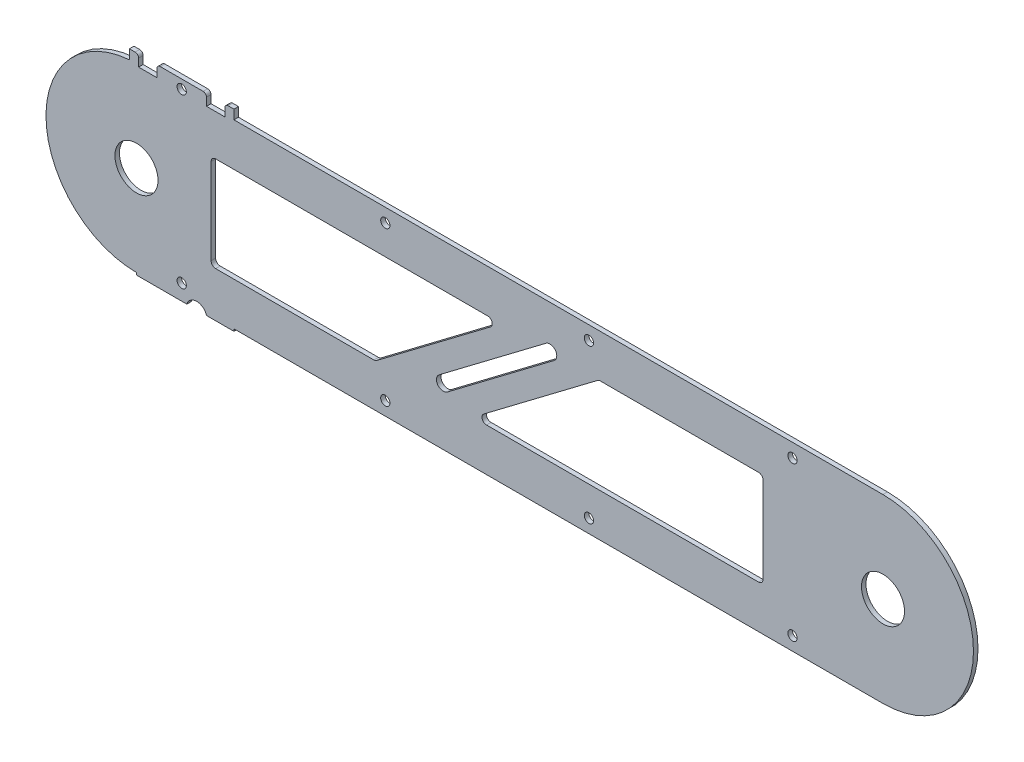
from build123d import *

# Parameters (mm, degrees)
SKETCH_1_R          = 9.52
EXTRUDE_1_DEPTH     = 2
SKETCH_4_W          = 43.1
SKETCH_4_H          = 0.98
SKETCH_4_W_2        = 46.2
SKETCH_4_H_2        = 8.602857229
EXTRUDE_2_DEPTH     = 2
SKETCH_2_R          = 2.05
CUT_EXTRUDE_1_DEPTH = 4
CUT_EXTRUDE_2_DEPTH = 10
FILLET_1_R          = 2
CUT_EXTRUDE_3_DEPTH = 2
FILLET_2_R          = 1.5


with BuildPart() as part:
    # 草图1 → 凸台-拉伸1 (new body)
    with BuildSketch(Plane.XY):
        with BuildLine():
            Line((328.542857143, -40.145714286), (-1.457142857, -40.145714286))
            ThreePointArc((-1.457142857, -40.145714286), (-41.457142857, -0.145714286), (-1.457142857, 39.854285714))
            Line((-1.457142857, 39.854285714), (328.542857143, 39.854285714))
            ThreePointArc((328.542857143, 39.854285714), (368.542857143, -0.145714286), (328.542857143, -40.145714286))
        make_face()
        with Locations((-1.457142857, -0.145714286)):
            Circle(SKETCH_1_R, mode=Mode.SUBTRACT)
        with Locations((328.542857143, -0.145714286)):
            Circle(SKETCH_1_R, mode=Mode.SUBTRACT)
    extrude(amount=EXTRUDE_1_DEPTH)

    # 草图4 → 凸台-拉伸2 (add)
    with BuildSketch(Plane.XY.offset(2)):
        with Locations((20.092857143, -40.635714286)):
            Rectangle(SKETCH_4_W, SKETCH_4_H)
        with Locations((18.542857143, 39.652857099)):
            Rectangle(SKETCH_4_W_2, SKETCH_4_H_2)
    extrude(amount=-EXTRUDE_2_DEPTH)

    # 草图2 → 切除-拉伸1 (cut)
    with BuildSketch(Plane.XY.offset(2)):
        with Locations((108.542857143, 33.854285714)):
            Circle(SKETCH_2_R)
        with Locations((198.542857143, 33.854285714)):
            Circle(SKETCH_2_R)
        with Locations((288.542857143, 33.854285714)):
            Circle(SKETCH_2_R)
        with Locations((108.542857143, -34.145714286)):
            Circle(SKETCH_2_R)
        with Locations((198.542857143, -34.145714286)):
            Circle(SKETCH_2_R)
        with Locations((288.542857143, -34.145714286)):
            Circle(SKETCH_2_R)
        with Locations((18.542857143, -34.145714286)):
            Circle(SKETCH_2_R)
        with Locations((18.542857143, 40.014285714)):
            Circle(SKETCH_2_R)
        Polygon((31.542857143, -21.145714286), (104.183898028, -21.145714286), (159.772133322, 20.854285714), (31.542857143, 20.854285714), align=None)
        Polygon((275.542857143, 20.854285714), (202.901816258, 20.854285714), (147.313580964, -21.145714286), (275.542857143, -21.145714286), align=None)
        Polygon((29.492857143, 41.064285714), (29.492857143, 38.964285714), (37.592857143, 38.964285714), (37.592857143, 41.064285714), (37.592857143, 53.579710622), (29.492857143, 53.579710622), align=None)
        Polygon((-0.507142857, 41.064285714), (-0.507142857, 38.964285714), (7.592857143, 38.964285714), (7.592857143, 41.064285714), (7.592857143, 53.579710622), (-0.507142857, 53.579710622), align=None)
    extrude(amount=-CUT_EXTRUDE_1_DEPTH, mode=Mode.SUBTRACT)

    # 草图3 → 切除-拉伸2 (cut)
    with BuildSketch(Plane.XY.offset(2)):
        with BuildLine():
            Line((183.145474057, 18.460683743), (135.97586329, -17.178577727))
            ThreePointArc((135.97586329, -17.178577727), (131.77376205, -16.593475022), (132.358864754, -12.391373783))
            Line((132.358864754, -12.391373783), (179.528475522, 23.247887686))
            ThreePointArc((179.528475522, 23.247887686), (183.730576762, 22.662784982), (183.145474057, 18.460683743))
        make_face()
    extrude(amount=-CUT_EXTRUDE_2_DEPTH, mode=Mode.SUBTRACT)

    # 圆角1
    fillet_1_edges = [part.edges().sort_by_distance(p)[0] for p in [
        (275.542857143, 20.854285714, 1),
        (275.542857143, -21.145714286, 1),
        (147.313580964, -21.145714286, 1),
        (202.901816258, 20.854285714, 1),
        (31.542857143, -21.145714286, 1),
        (31.542857143, 20.854285714, 1),
        (159.772133322, 20.854285714, 1),
        (104.183898028, -21.145714286, 1),
    ]]
    fillet(fillet_1_edges, radius=FILLET_1_R)

    # 草图5 → 切除-拉伸3 (cut)
    with BuildSketch(Plane.XY.offset(2)):
        with BuildLine():
            Line((20.806207352, -41.125714286), (29.507867411, -41.125714286))
            ThreePointArc((29.507867411, -41.125714286), (25.157037382, -37.88123609), (20.806207352, -41.125714286))
        make_face()
    extrude(amount=-CUT_EXTRUDE_3_DEPTH, mode=Mode.SUBTRACT)

    # 圆角2
    fillet_2_edges = [part.edges().sort_by_distance(p)[0] for p in [
        (37.592857143, 43.954285714, 1),
        (29.492857143, 43.954285714, 1),
        (-0.507142857, 43.954285714, 1),
        (7.592857143, 43.954285714, 1),
    ]]
    fillet(fillet_2_edges, radius=FILLET_2_R)


solid = part.part
